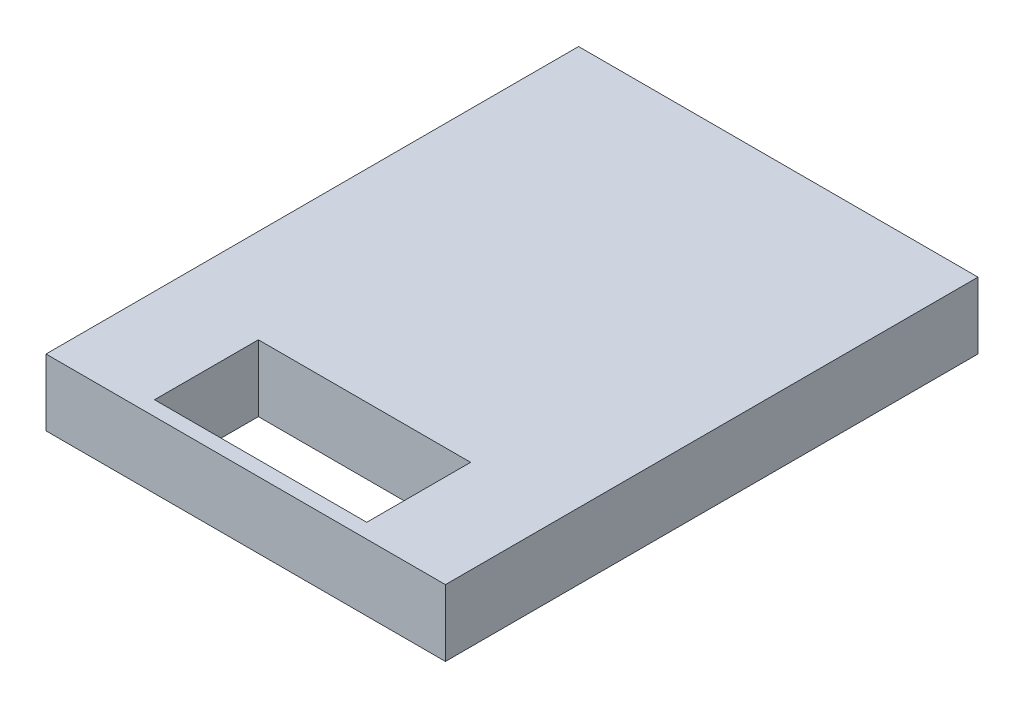
from build123d import *

# Parameters (mm, degrees)
SKETCH1_W           = 76.2
SKETCH1_H           = 101.6
SKETCH1_W_2         = 40.491366427
SKETCH1_H_2         = 19.812
BOSS_EXTRUDE1_DEPTH = 12.7


with BuildPart() as part:
    # Sketch1 → Boss-Extrude1 (new body)
    with BuildSketch(Plane(origin=(0, 0, 0), x_dir=(1, 0, 0), z_dir=(0, 1, 0))):
        with Locations((38.1, 50.8)):
            Rectangle(SKETCH1_W, SKETCH1_H)
        with Locations((38.152683214, 12.7)):
            Rectangle(SKETCH1_W_2, SKETCH1_H_2, mode=Mode.SUBTRACT)
    extrude(amount=BOSS_EXTRUDE1_DEPTH)


solid = part.part
